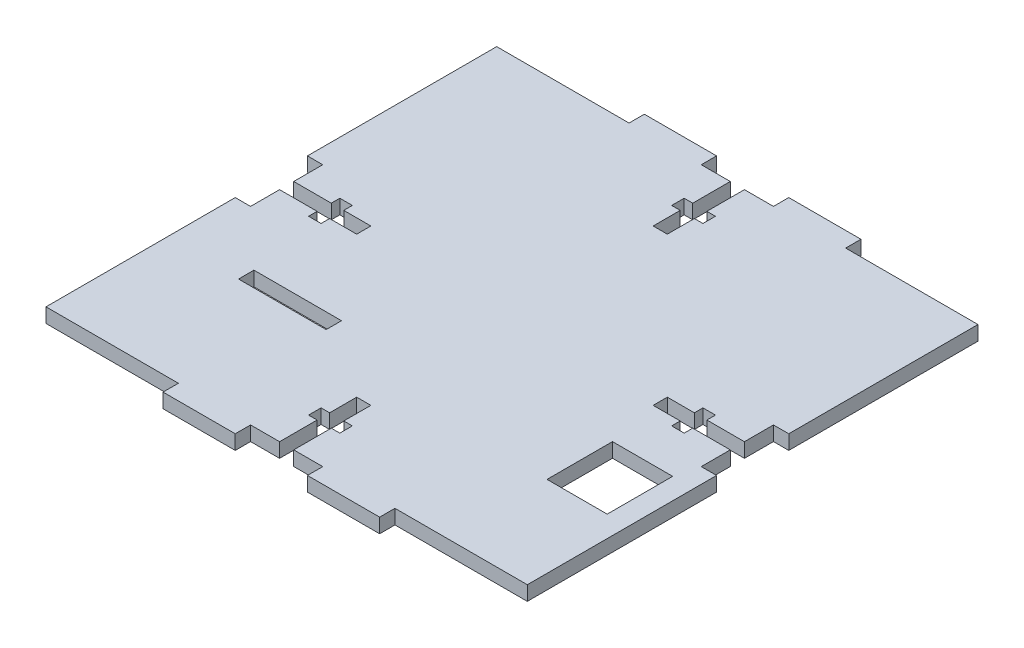
from build123d import *

# Parameters (mm, degrees)
SKETCH1_W                = 100
SKETCH1_H                = 100
BOSS_EXTRUDE1_DEPTH      = 1.5
CUT_EXTRUDE6_DEPTH       = 71.774289117
SKETCH4_W                = 27.5
SKETCH4_H                = 3.18
CUT_EXTRUDE9_DEPTH       = 3
CUT_EXTRUDE10_DEPTH      = 3
MIRROR10_COPY_1_SKETCH_W = 27.5
MIRROR10_COPY_1_SKETCH_H = 3.18
MIRROR10_COPY_1_DEPTH    = 3
SKETCH27_W               = 18.2
SKETCH27_H               = 3.2
CUT_EXTRUDE19_DEPTH      = 3
SKETCH38_W               = 12.6
SKETCH38_H               = 13.5
BOSS_EXTRUDE5_DEPTH      = 3
SKETCH39_W               = 12.5
SKETCH39_H               = 13.6
CUT_EXTRUDE30_DEPTH      = 3


with BuildPart() as part:
    # Sketch1 → Boss-Extrude1 (new, symmetric)
    with BuildSketch(Plane(origin=(0, 0, 0), x_dir=(1, 0, 0), z_dir=(0, 1, 0))):
        Rectangle(SKETCH1_W, SKETCH1_H)
    extrude(amount=BOSS_EXTRUDE1_DEPTH, both=True)

    # Sketch2 → Cut-Extrude6 (cut, through all)
    with BuildSketch(Plane(origin=(0, 1.5, 0), x_dir=(1, 0, 0), z_dir=(0, 1, 0))):
        Polygon((-7.5, -50), (-7.5, -46.82), (-1.47, -46.82), (-1.47, -39.02), (-3.25, -39.02), (-3.25, -36.42), (-1.47, -36.42), (-1.47, -30.8), (1.47, -30.8), (1.47, -36.42), (3.25, -36.42), (3.25, -39.02), (1.47, -39.02), (1.47, -46.82), (7.5, -46.82), (7.5, -50), align=None)
    cut_extrude6 = extrude(amount=-CUT_EXTRUDE6_DEPTH, mode=Mode.SUBTRACT)

    # Mirror1: Cut-Extrude6 across plane
    add(cut_extrude6.mirror(Plane.XY), mode=Mode.SUBTRACT)

    # Sketch4 → Cut-Extrude9 (cut)
    with BuildSketch(Plane(origin=(0, 1.5, 0), x_dir=(1, 0, 0), z_dir=(0, 1, 0))):
        with Locations((-36.25, 48.41)):
            Rectangle(SKETCH4_W, SKETCH4_H)
    cut_extrude9 = extrude(amount=-CUT_EXTRUDE9_DEPTH, mode=Mode.SUBTRACT)

    # Sketch5 → Cut-Extrude10 (cut)
    with BuildSketch(Plane.XZ.offset(1.5)):
        Polygon((50, -7.5), (50, 7.5), (46.82, 7.5), (46.82, 1.47), (39.02, 1.47), (39.02, 3.25), (36.42, 3.25), (36.42, 1.47), (30.8, 1.47), (30.8, -1.47), (36.42, -1.47), (36.42, -3.25), (39.02, -3.25), (39.02, -1.47), (46.82, -1.47), (46.82, -7.5), align=None)
    cut_extrude10 = extrude(amount=-CUT_EXTRUDE10_DEPTH, mode=Mode.SUBTRACT)

    # Mirror6: Cut-Extrude10 across plane
    add(cut_extrude10.mirror(Plane(origin=(0, 0, 0), x_dir=(0, 0, 1), z_dir=(1, 0, 0))), mode=Mode.SUBTRACT)

    # Mirror9: Cut-Extrude9 across plane
    add(cut_extrude9.mirror(Plane.XY), mode=Mode.SUBTRACT)

    # Mirror10: Cut-Extrude9 across plane
    add(cut_extrude9.mirror(Plane(origin=(0, 0, 0), x_dir=(0, 0, 1), z_dir=(1, 0, 0))), mode=Mode.SUBTRACT)

    # Mirror10 copy 1 sketch → Mirror10 copy 1 (cut)
    with BuildSketch(Plane(origin=(0, 1.5, 0), x_dir=(-1, 0, 0), z_dir=(0, 1, 0))):
        with Locations((-36.25, 48.41)):
            Rectangle(MIRROR10_COPY_1_SKETCH_W, MIRROR10_COPY_1_SKETCH_H)
    extrude(amount=-MIRROR10_COPY_1_DEPTH, mode=Mode.SUBTRACT)

    # Sketch27 → Cut-Extrude19 (cut)
    with BuildSketch(Plane.XZ.offset(1.5)):
        with Locations((-25.9, 20.22)):
            Rectangle(SKETCH27_W, SKETCH27_H)
    extrude(amount=-CUT_EXTRUDE19_DEPTH, mode=Mode.SUBTRACT)

    # Sketch38 → Boss-Extrude5 (add)
    with BuildSketch(Plane(origin=(0, 1.5, 0), x_dir=(1, 0, 0), z_dir=(0, 1, 0))):
        with Locations((40.4, -19.07)):
            Rectangle(SKETCH38_W, SKETCH38_H)
    extrude(amount=-BOSS_EXTRUDE5_DEPTH)

    # Sketch39 → Cut-Extrude30 (cut)
    with BuildSketch(Plane(origin=(0, 1.5, 0), x_dir=(1, 0, 0), z_dir=(0, 1, 0))):
        with Locations((39.35, -19.02)):
            Rectangle(SKETCH39_W, SKETCH39_H)
    extrude(amount=-CUT_EXTRUDE30_DEPTH, mode=Mode.SUBTRACT)


solid = part.part
